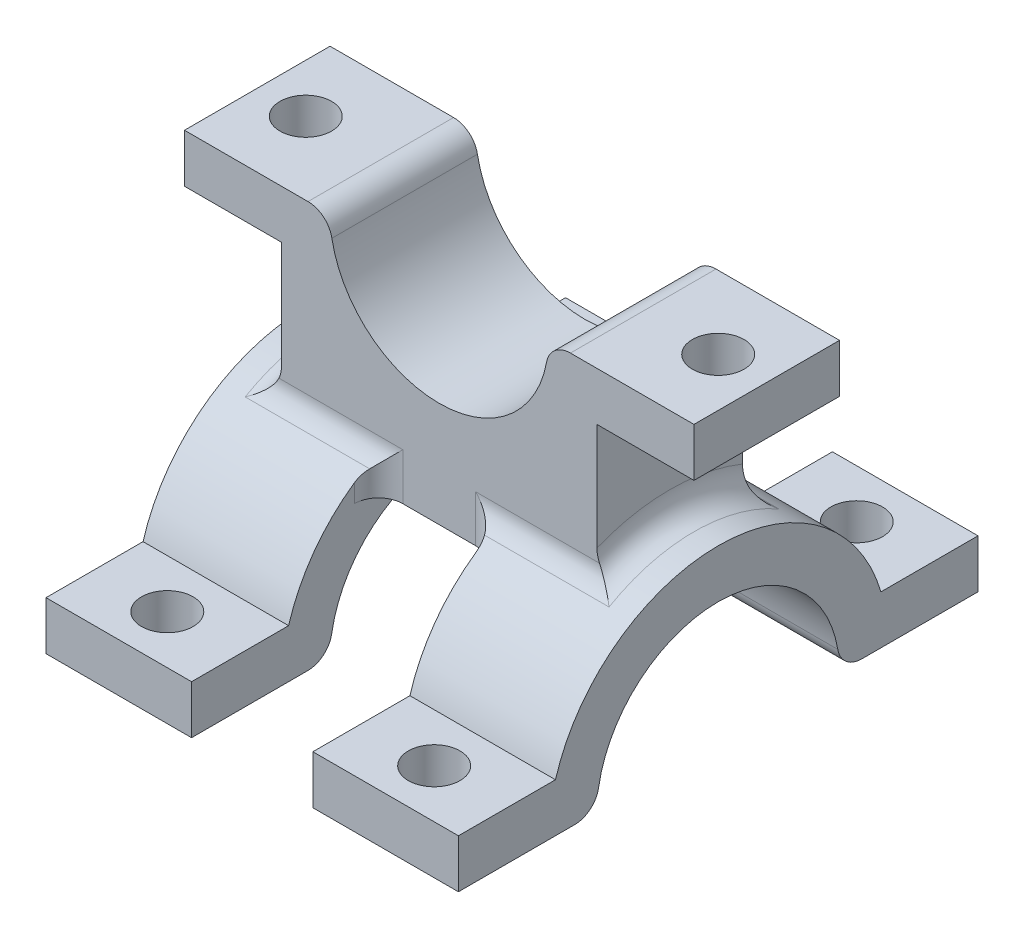
from build123d import *

# Parameters (mm, degrees)
BOSS_EXTRUDE1_DEPTH = 19.05
SKETCH7_R           = 3.3782
CUT_EXTRUDE3_DEPTH  = 233.356054205
BOSS_EXTRUDE3_START = -6.35
BOSS_EXTRUDE3_DEPTH = 19.05
SKETCH11_R          = 3.3782
CUT_EXTRUDE4_DEPTH  = 238.616089602
FILLET4_R           = 3.175


with BuildPart() as part:
    # Sketch1 → Boss-Extrude1 (new body)
    with BuildSketch(Plane.XY):
        with BuildLine():
            Line((-182.9308, 127.79756), (-163.8808, 127.79756))
            Line((-163.8808, 127.79756), (-163.8808, 121.44756))
            Line((-163.8808, 121.44756), (-176.5808, 121.44756))
            Line((-176.5808, 121.44756), (-176.5808, 99.757550505))
            Line((-176.5808, 99.757550505), (-217.8558, 99.757550505))
            Line((-217.8558, 99.757550505), (-217.8558, 121.44756))
            Line((-217.8558, 121.44756), (-230.5558, 121.44756))
            Line((-230.5558, 121.44756), (-230.5558, 127.79756))
            Line((-230.5558, 127.79756), (-211.5058, 127.79756))
            ThreePointArc((-211.5058, 127.79756), (-197.2183, 113.51006), (-182.9308, 127.79756))
        make_face()
    extrude(amount=BOSS_EXTRUDE1_DEPTH)

    # Sketch7 → Cut-Extrude3 (cut, through all)
    with BuildSketch(Plane.XZ.offset(-121.44756)):
        with Locations((-170.2308, 9.525)):
            Circle(SKETCH7_R)
        with Locations((-224.2058, 9.525)):
            Circle(SKETCH7_R)
    extrude(amount=-CUT_EXTRUDE3_DEPTH, mode=Mode.SUBTRACT)

    # Sketch10 → Boss-Extrude3 (add)
    with BuildSketch(Plane(origin=(-163.8808, 0, 0), x_dir=(0, 0, -1), z_dir=(1, 0, 0)).offset(BOSS_EXTRUDE3_START)):
        with BuildLine():
            Line((6.35, 83.882550505), (24.473547486, 83.882550505))
            Line((24.473547486, 83.882550505), (24.473547486, 90.232550505))
            Line((24.473547486, 90.232550505), (11.773547486, 90.232550505))
            ThreePointArc((11.773547486, 90.232550505), (-9.525, 106.107550505), (-30.823547486, 90.232550505))
            Line((-30.823547486, 90.232550505), (-43.523547486, 90.232550505))
            Line((-43.523547486, 90.232550505), (-43.523547486, 83.882550505))
            Line((-43.523547486, 83.882550505), (-25.4, 83.882550505))
            ThreePointArc((-25.4, 83.882550505), (-9.525, 99.757550505), (6.35, 83.882550505))
        make_face()
    boss_extrude3 = extrude(amount=-BOSS_EXTRUDE3_DEPTH)

    # Mirror3: Boss-Extrude3 across plane
    add(boss_extrude3.mirror(Plane(origin=(-197.2183, 0, 0), x_dir=(0, 0, 1), z_dir=(1, 0, 0))))

    # Sketch11 → Cut-Extrude4 (cut, through all)
    with BuildSketch(Plane(origin=(0, 90.232550505, 0), x_dir=(1, 0, 0), z_dir=(0, 1, 0))):
        with Locations(Location((-179.7558, -37.173547486, 0), (0, 0, 270))):
            Circle(SKETCH11_R)
        with Locations(Location((-179.7558, 18.123547486, 0), (0, 0, 270))):
            Circle(SKETCH11_R)
        with Locations(Location((-214.6808, 18.123547486, 0), (0, 0, 270))):
            Circle(SKETCH11_R)
        with Locations(Location((-214.6808, -37.173547486, 0), (0, 0, 270))):
            Circle(SKETCH11_R)
    extrude(amount=-CUT_EXTRUDE4_DEPTH, mode=Mode.SUBTRACT)

    # Fillet4
    fillet4_edges = [part.edges().sort_by_distance(p)[0] for p in [
        (-182.9308, 127.79756, 9.525),
        (-211.5058, 127.79756, 9.525),
        (-189.2808, 101.860282076, 0),
        (-182.9308, 103.963013647, 0),
        (-189.2808, 101.860282076, 19.05),
        (-179.7558, 83.882550505, -6.35),
        (-179.7558, 83.882550505, 25.4),
        (-182.9308, 103.963013647, 19.05),
        (-176.5808, 106.107550505, 9.525),
        (-205.1558, 101.860282076, 0),
        (-211.5058, 103.963013647, 0),
        (-211.5058, 103.963013647, 19.05),
        (-217.8558, 106.107550505, 9.525),
        (-205.1558, 101.860282076, 19.05),
        (-214.6808, 83.882550505, 25.4),
        (-214.6808, 83.882550505, -6.35),
    ]]
    fillet(fillet4_edges, radius=FILLET4_R)


solid = part.part
